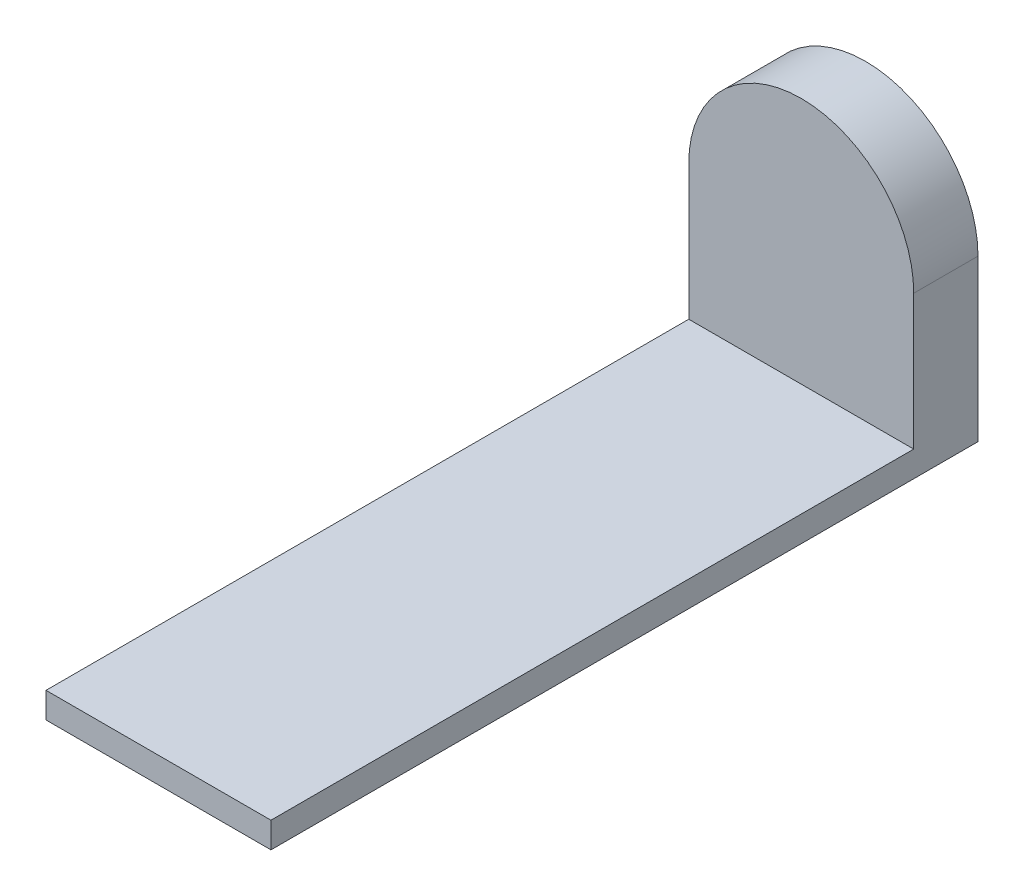
from build123d import *

# Parameters (mm, degrees)
EXTRUDE_1_DEPTH = 10
SKETCH_2_W      = 35
SKETCH_2_H      = 4
EXTRUDE_2_DEPTH = 100


with BuildPart() as part:
    # 草图1 → 凸台-拉伸1 (new body)
    with BuildSketch(Plane.XY):
        with BuildLine():
            Line((-17.5, 0), (-17.5, -25))
            Line((-17.5, -25), (17.5, -25))
            Line((17.5, -25), (17.5, 0))
            ThreePointArc((17.5, 0), (0, 17.5), (-17.5, 0))
        make_face()
    extrude(amount=EXTRUDE_1_DEPTH)

    # 草图2 → 凸台-拉伸2 (add)
    with BuildSketch(Plane.XY.offset(10)):
        with Locations((0, -23)):
            Rectangle(SKETCH_2_W, SKETCH_2_H)
    extrude(amount=EXTRUDE_2_DEPTH)


solid = part.part
